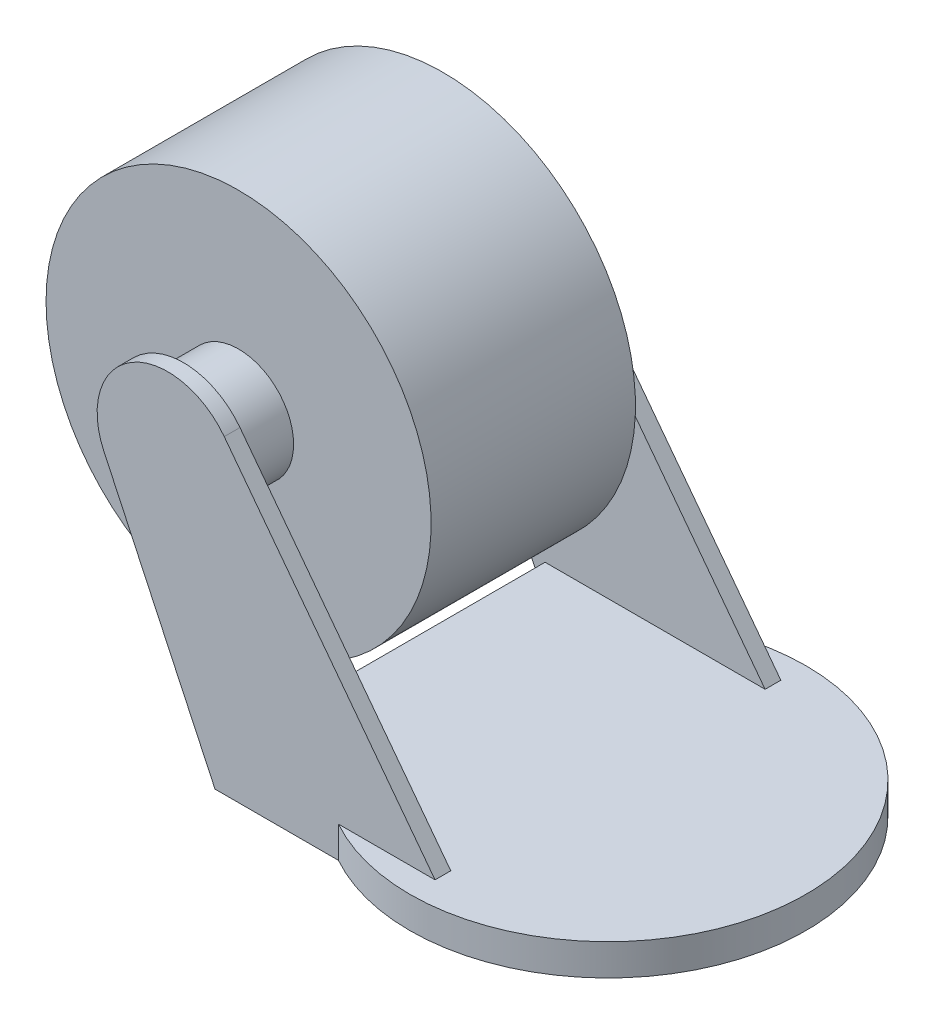
from build123d import *

# Parameters (mm, degrees)
BOSS_EXTRUDE1_DEPTH = 2
BOSS_EXTRUDE2_DEPTH = 1
SKETCH3_R           = 3.5
BOSS_EXTRUDE4_DEPTH = 11
SKETCH4_R           = 12.25
BOSS_EXTRUDE5_DEPTH = 6.5


with BuildPart() as part:
    # Sketch1 → Boss-Extrude1 (new body)
    with BuildSketch(Plane(origin=(0, 0, 0), x_dir=(1, 0, 0), z_dir=(0, 1, 0))):
        with BuildLine():
            Line((-14, 10), (-7.665507159, 10))
            ThreePointArc((-7.665507159, 10), (12.6, 0), (-7.665507159, -10))
            Line((-7.665507159, -10), (-14, -10))
            Line((-14, -10), (-14, 10))
        make_face()
    extrude(amount=BOSS_EXTRUDE1_DEPTH)

    # Sketch2 → Boss-Extrude2 (add)
    with BuildSketch(Plane.XY.offset(10)):
        with BuildLine():
            Line((0, 2), (-13.412192981, 19.716181289))
            ThreePointArc((-13.412192981, 19.716181289), (-19.325951381, 20.85226559), (-21.074450498, 15.089802853))
            Line((-21.074450498, 15.089802853), (-14, 0))
            Line((-14, 0), (0, 0))
            Line((0, 0), (0, 2))
        make_face()
    boss_extrude2 = extrude(amount=BOSS_EXTRUDE2_DEPTH)

    # Sketch3 → Boss-Extrude4 (add)
    with BuildSketch(Plane.XY.offset(11)):
        with Locations((-17, 17)):
            Circle(SKETCH3_R)
    boss_extrude4 = extrude(amount=-BOSS_EXTRUDE4_DEPTH)

    # Mirror1: Boss-Extrude2, Boss-Extrude4 across plane
    add(boss_extrude2.mirror(Plane.XY))
    add(boss_extrude4.mirror(Plane.XY))

    # Sketch4 → Boss-Extrude5 (add, symmetric)
    with BuildSketch(Plane.XY):
        with Locations(Location((-17, 17, 0), (0, 0, 180))):
            Circle(SKETCH4_R)
    extrude(amount=BOSS_EXTRUDE5_DEPTH, both=True)


solid = part.part
